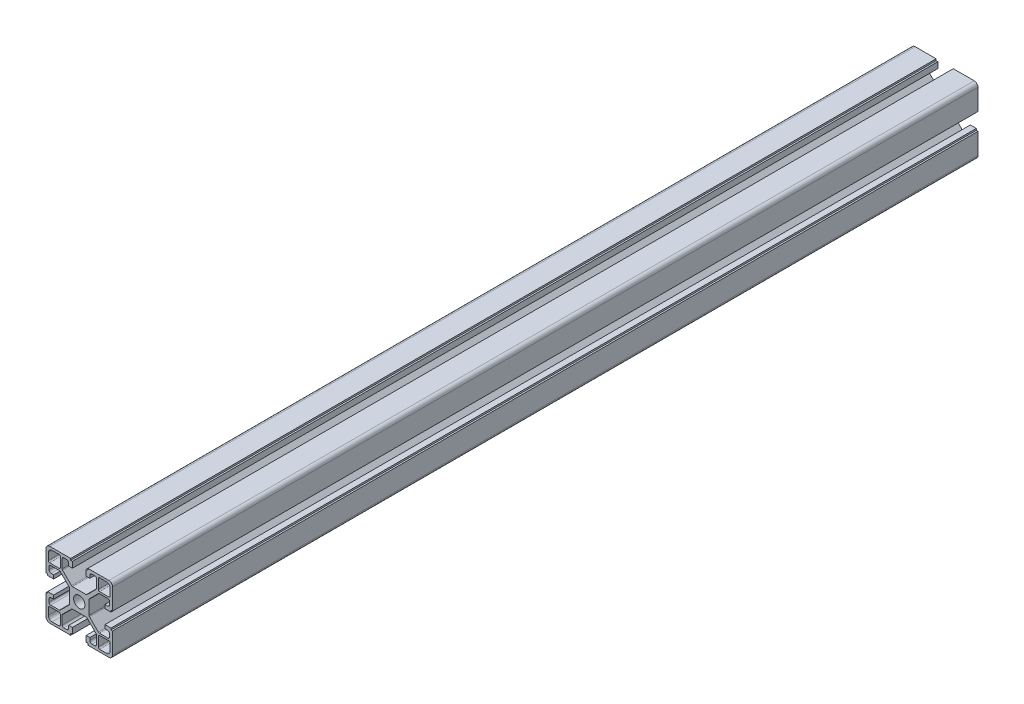
from build123d import *

# Parameters (mm, degrees)
SKETCH1_R           = 3.4
BOSS_EXTRUDE1_DEPTH = 713
SKETCH2_W           = 40
SKETCH2_H           = 193
CUT_EXTRUDE1_DEPTH  = 715.401147815


with BuildPart() as part:
    # Sketch1 → Boss-Extrude1 (new body)
    with BuildSketch(Plane.XY):
        with BuildLine():
            Line((20, 17.75), (20, 5.15))
            Line((20, 5.15), (19, 5.15))
            Line((19, 5.15), (19, 4.15))
            Line((19, 4.15), (15.4, 4.15))
            Line((15.4, 4.15), (15.4, 6.35))
            Line((15.4, 6.35), (16.95, 6.35))
            ThreePointArc((16.95, 6.35), (17.833883476, 6.716116524), (18.2, 7.6))
            Line((18.2, 7.6), (18.2, 9.3))
            ThreePointArc((18.2, 9.3), (17.907106781, 10.007106781), (17.2, 10.3))
            Line((17.2, 10.3), (12.03669957, 10.3))
            ThreePointArc((12.03669957, 10.3), (11.73040037, 10.239040459), (11.470780817, 10.065452001))
            Line((11.470780817, 10.065452001), (6.084081247, 4.674305984))
            ThreePointArc((6.084081247, 4.674305984), (5.910833239, 4.414848262), (5.85, 4.108853983))
            Line((5.85, 4.108853983), (5.85, -4.108853983))
            ThreePointArc((5.85, -4.108853983), (5.910833239, -4.414848262), (6.084081247, -4.674305984))
            Line((6.084081247, -4.674305984), (11.470780817, -10.065452001))
            ThreePointArc((11.470780817, -10.065452001), (11.73040037, -10.239040459), (12.03669957, -10.3))
            Line((12.03669957, -10.3), (17.2, -10.3))
            ThreePointArc((17.2, -10.3), (17.907106781, -10.007106781), (18.2, -9.3))
            Line((18.2, -9.3), (18.2, -7.6))
            ThreePointArc((18.2, -7.6), (17.833883476, -6.716116524), (16.95, -6.35))
            Line((16.95, -6.35), (15.4, -6.35))
            Line((15.4, -6.35), (15.4, -4.15))
            Line((15.4, -4.15), (19, -4.15))
            Line((19, -4.15), (19, -5.15))
            Line((19, -5.15), (20, -5.15))
            Line((20, -5.15), (20, -17.75))
            ThreePointArc((20, -17.75), (19.340990258, -19.340990258), (17.75, -20))
            Line((17.75, -20), (5.15, -20))
            Line((5.15, -20), (5.15, -19))
            Line((5.15, -19), (4.15, -19))
            Line((4.15, -19), (4.15, -15.4))
            Line((4.15, -15.4), (6.35, -15.4))
            Line((6.35, -15.4), (6.35, -16.95))
            ThreePointArc((6.35, -16.95), (6.716116524, -17.833883476), (7.6, -18.2))
            Line((7.6, -18.2), (9.3, -18.2))
            ThreePointArc((9.3, -18.2), (10.007106781, -17.907106781), (10.3, -17.2))
            Line((10.3, -17.2), (10.3, -12.054477022))
            ThreePointArc((10.3, -12.054477022), (10.239166761, -11.748482743), (10.065918753, -11.489025021))
            Line((10.065918753, -11.489025021), (4.665899173, -6.084547999))
            ThreePointArc((4.665899173, -6.084547999), (4.406279619, -5.910959541), (4.09998042, -5.85))
            Line((4.09998042, -5.85), (-4.09998042, -5.85))
            ThreePointArc((-4.09998042, -5.85), (-4.406279619, -5.910959541), (-4.665899173, -6.084547999))
            Line((-4.665899173, -6.084547999), (-10.065918753, -11.489025021))
            ThreePointArc((-10.065918753, -11.489025021), (-10.239166761, -11.748482743), (-10.3, -12.054477022))
            Line((-10.3, -12.054477022), (-10.3, -17.2))
            ThreePointArc((-10.3, -17.2), (-10.007106781, -17.907106781), (-9.3, -18.2))
            Line((-9.3, -18.2), (-7.6, -18.2))
            ThreePointArc((-7.6, -18.2), (-6.716116524, -17.833883476), (-6.35, -16.95))
            Line((-6.35, -16.95), (-6.35, -15.4))
            Line((-6.35, -15.4), (-4.15, -15.4))
            Line((-4.15, -15.4), (-4.15, -19))
            Line((-4.15, -19), (-5.15, -19))
            Line((-5.15, -19), (-5.15, -20))
            Line((-5.15, -20), (-17.75, -20))
            ThreePointArc((-17.75, -20), (-19.340990258, -19.340990258), (-20, -17.75))
            Line((-20, -17.75), (-20, -5.15))
            Line((-20, -5.15), (-19, -5.15))
            Line((-19, -5.15), (-19, -4.15))
            Line((-19, -4.15), (-15.4, -4.15))
            Line((-15.4, -4.15), (-15.4, -6.35))
            Line((-15.4, -6.35), (-16.95, -6.35))
            ThreePointArc((-16.95, -6.35), (-17.833883476, -6.716116524), (-18.2, -7.6))
            Line((-18.2, -7.6), (-18.2, -9.3))
            ThreePointArc((-18.2, -9.3), (-17.907106781, -10.007106781), (-17.2, -10.3))
            Line((-17.2, -10.3), (-12.03669957, -10.3))
            ThreePointArc((-12.03669957, -10.3), (-11.73040037, -10.239040459), (-11.470780817, -10.065452001))
            Line((-11.470780817, -10.065452001), (-6.084081247, -4.674305984))
            ThreePointArc((-6.084081247, -4.674305984), (-5.910833239, -4.414848262), (-5.85, -4.108853983))
            Line((-5.85, -4.108853983), (-5.85, 4.108853983))
            ThreePointArc((-5.85, 4.108853983), (-5.910833239, 4.414848262), (-6.084081247, 4.674305984))
            Line((-6.084081247, 4.674305984), (-11.470780817, 10.065452001))
            ThreePointArc((-11.470780817, 10.065452001), (-11.73040037, 10.239040459), (-12.03669957, 10.3))
            Line((-12.03669957, 10.3), (-17.2, 10.3))
            ThreePointArc((-17.2, 10.3), (-17.907106781, 10.007106781), (-18.2, 9.3))
            Line((-18.2, 9.3), (-18.2, 7.6))
            ThreePointArc((-18.2, 7.6), (-17.833883476, 6.716116524), (-16.95, 6.35))
            Line((-16.95, 6.35), (-15.4, 6.35))
            Line((-15.4, 6.35), (-15.4, 4.15))
            Line((-15.4, 4.15), (-19, 4.15))
            Line((-19, 4.15), (-19, 5.15))
            Line((-19, 5.15), (-20, 5.15))
            Line((-20, 5.15), (-20, 17.75))
            ThreePointArc((-20, 17.75), (-19.340990258, 19.340990258), (-17.75, 20))
            Line((-17.75, 20), (-5.15, 20))
            Line((-5.15, 20), (-5.15, 19))
            Line((-5.15, 19), (-4.15, 19))
            Line((-4.15, 19), (-4.15, 15.4))
            Line((-4.15, 15.4), (-6.35, 15.4))
            Line((-6.35, 15.4), (-6.35, 16.95))
            ThreePointArc((-6.35, 16.95), (-6.716116524, 17.833883476), (-7.6, 18.2))
            Line((-7.6, 18.2), (-9.3, 18.2))
            ThreePointArc((-9.3, 18.2), (-10.007106781, 17.907106781), (-10.3, 17.2))
            Line((-10.3, 17.2), (-10.3, 12.054477022))
            ThreePointArc((-10.3, 12.054477022), (-10.239166761, 11.748482743), (-10.065918753, 11.489025021))
            Line((-10.065918753, 11.489025021), (-4.665899173, 6.084547999))
            ThreePointArc((-4.665899173, 6.084547999), (-4.406279619, 5.910959541), (-4.09998042, 5.85))
            Line((-4.09998042, 5.85), (4.09998042, 5.85))
            ThreePointArc((4.09998042, 5.85), (4.406279619, 5.910959541), (4.665899173, 6.084547999))
            Line((4.665899173, 6.084547999), (10.065918753, 11.489025021))
            ThreePointArc((10.065918753, 11.489025021), (10.239166761, 11.748482743), (10.3, 12.054477022))
            Line((10.3, 12.054477022), (10.3, 17.2))
            ThreePointArc((10.3, 17.2), (10.007106781, 17.907106781), (9.3, 18.2))
            Line((9.3, 18.2), (7.6, 18.2))
            ThreePointArc((7.6, 18.2), (6.716116524, 17.833883476), (6.35, 16.95))
            Line((6.35, 16.95), (6.35, 15.4))
            Line((6.35, 15.4), (4.15, 15.4))
            Line((4.15, 15.4), (4.15, 19))
            Line((4.15, 19), (5.15, 19))
            Line((5.15, 19), (5.15, 20))
            Line((5.15, 20), (17.75, 20))
            ThreePointArc((17.75, 20), (19.340990258, 19.340990258), (20, 17.75))
        make_face()
        with Locations(Location((0, 0, 0), (0, 0, 180))):
            Circle(SKETCH1_R, mode=Mode.SUBTRACT)
        with BuildLine():
            Line((18.6, 16.35), (18.6, 12.2))
            ThreePointArc((18.6, 12.2), (18.365685425, 11.634314575), (17.8, 11.4))
            Line((17.8, 11.4), (12.2, 11.4))
            ThreePointArc((12.2, 11.4), (11.634314575, 11.634314575), (11.4, 12.2))
            Line((11.4, 12.2), (11.4, 17.8))
            ThreePointArc((11.4, 17.8), (11.634314575, 18.365685425), (12.2, 18.6))
            Line((12.2, 18.6), (16.35, 18.6))
            ThreePointArc((16.35, 18.6), (17.940990258, 17.940990258), (18.6, 16.35))
        make_face(mode=Mode.SUBTRACT)
        with BuildLine():
            Line((-12.2, 18.6), (-16.35, 18.6))
            ThreePointArc((-16.35, 18.6), (-17.940990258, 17.940990258), (-18.6, 16.35))
            Line((-18.6, 16.35), (-18.6, 12.2))
            ThreePointArc((-18.6, 12.2), (-18.365685425, 11.634314575), (-17.8, 11.4))
            Line((-17.8, 11.4), (-12.2, 11.4))
            ThreePointArc((-12.2, 11.4), (-11.634314575, 11.634314575), (-11.4, 12.2))
            Line((-11.4, 12.2), (-11.4, 17.8))
            ThreePointArc((-11.4, 17.8), (-11.634314575, 18.365685425), (-12.2, 18.6))
        make_face(mode=Mode.SUBTRACT)
        with BuildLine():
            Line((-18.6, -16.35), (-18.6, -12.2))
            ThreePointArc((-18.6, -12.2), (-18.365685425, -11.634314575), (-17.8, -11.4))
            Line((-17.8, -11.4), (-12.2, -11.4))
            ThreePointArc((-12.2, -11.4), (-11.634314575, -11.634314575), (-11.4, -12.2))
            Line((-11.4, -12.2), (-11.4, -17.8))
            ThreePointArc((-11.4, -17.8), (-11.634314575, -18.365685425), (-12.2, -18.6))
            Line((-12.2, -18.6), (-16.35, -18.6))
            ThreePointArc((-16.35, -18.6), (-17.940990258, -17.940990258), (-18.6, -16.35))
        make_face(mode=Mode.SUBTRACT)
        with BuildLine():
            Line((12.2, -18.6), (16.35, -18.6))
            ThreePointArc((16.35, -18.6), (17.940990258, -17.940990258), (18.6, -16.35))
            Line((18.6, -16.35), (18.6, -12.2))
            ThreePointArc((18.6, -12.2), (18.365685425, -11.634314575), (17.8, -11.4))
            Line((17.8, -11.4), (12.2, -11.4))
            ThreePointArc((12.2, -11.4), (11.634314575, -11.634314575), (11.4, -12.2))
            Line((11.4, -12.2), (11.4, -17.8))
            ThreePointArc((11.4, -17.8), (11.634314575, -18.365685425), (12.2, -18.6))
        make_face(mode=Mode.SUBTRACT)
    extrude(amount=BOSS_EXTRUDE1_DEPTH)

    # Sketch2 → Cut-Extrude1 (cut, through all)
    with BuildSketch(Plane(origin=(0, 20, 0), x_dir=(1, 0, 0), z_dir=(0, 1, 0))):
        with Locations((0, -616.5)):
            Rectangle(SKETCH2_W, SKETCH2_H)
    extrude(amount=-CUT_EXTRUDE1_DEPTH, mode=Mode.SUBTRACT)


solid = part.part
